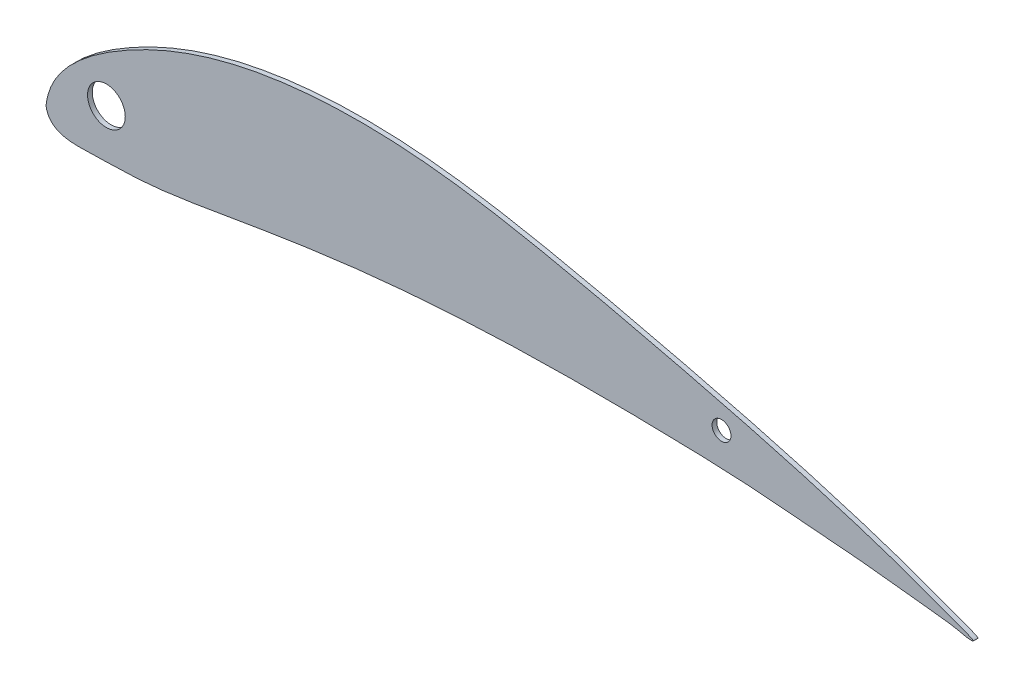
from build123d import *

# Parameters (mm, degrees)
BOSS_EXTRUDE1_DEPTH = 1.5875
SKETCH2_R           = 6.35
SKETCH2_R_2         = 3.175
CUT_EXTRUDE1_DEPTH  = 316.731983488


with BuildPart() as part:
    # Sketch1 → Boss-Extrude1 (new body)
    with BuildSketch(Plane.XY):
        with BuildLine():
            add(Edge.make_bspline(
                [(0.000560351, 0.000130087), (0.810633127, 7.359196055), (8.649092025, 17.856605174), (26.286719818, 29.975176328), (52.111128271, 42.069215275), (89.597618475, 49.290763054), (131.400792109, 47.884831915), (173.256699242, 40.041104278), (217.961060472, 29.612974894), (256.952064401, 19.528920948), (290.35983767, 8.71099439), (301.273197721, 4.382828139), (314.816918223, -0.516206742), (309.846313895, 0.000130087)],
                knots=[0, 0, 0, 0, 0.060863618, 0.113688265, 0.188608742, 0.312908923, 0.448482434, 0.557612135, 0.691544113, 0.852438279, 0.92975597, 0.976058229, 1, 1, 1, 1], degree=3))
            add(Edge.make_bspline(
                [(309.846313895, 0.000130087), (303.956832565, 1.47095521), (293.989507544, 2.093987313), (276.26402299, 4.514356704), (260.846344817, 5.427413394), (235.858814759, 7.870306192), (205.101424636, 8.838080282), (157.718638092, 9.030650149), (110.497331172, 6.181495223), (66.506197185, -0.586669107), (36.454672816, -6.098499901), (15.316603331, -6.189065841), (1.230714189, -6.924076091), (0.000560351, 0.000130087)],
                knots=[0, 0, 0, 0, 0.057787081, 0.095274891, 0.171021118, 0.205339302, 0.335319146, 0.464904334, 0.658702312, 0.785511947, 0.893517288, 0.94309214, 1, 1, 1, 1], degree=3))
        make_face()
    extrude(amount=BOSS_EXTRUDE1_DEPTH)

    # Sketch2 → Cut-Extrude1 (cut, through all)
    with BuildSketch(Plane.XY.offset(1.5875)):
        with Locations((20.32, 10.16)):
            Circle(SKETCH2_R)
        with Locations((227.296313895, 19.050130087)):
            Circle(SKETCH2_R_2)
    extrude(amount=-CUT_EXTRUDE1_DEPTH, mode=Mode.SUBTRACT)


solid = part.part
